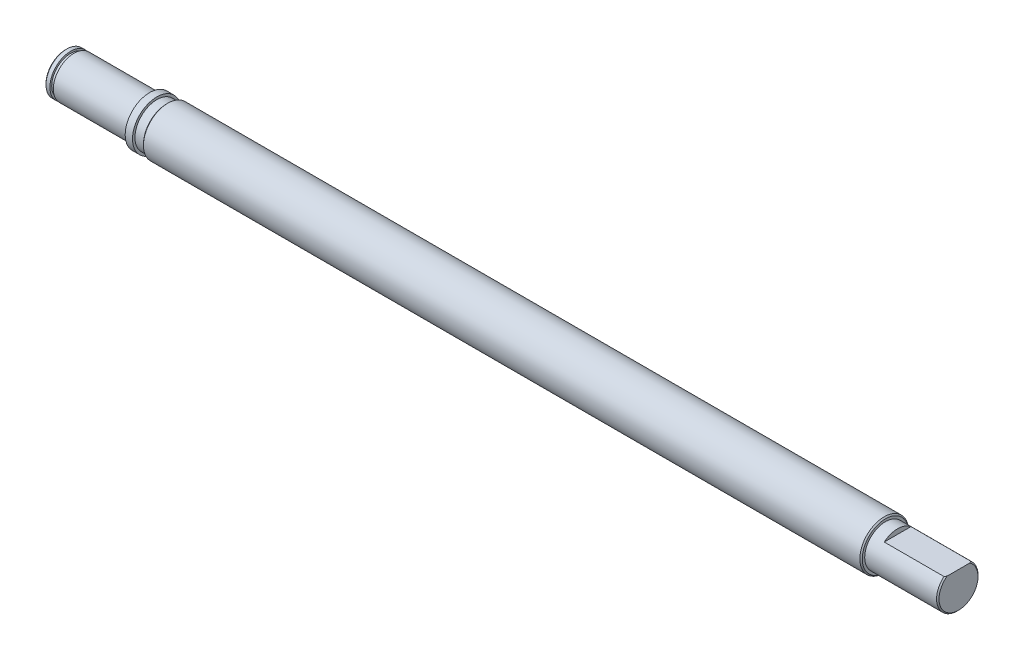
from build123d import *

# Parameters (mm, degrees)
CHAMFER_1_SIZE      = 0.5
CUT_EXTRUDE_START   = -25
CUT_EXTRUDE_1_DEPTH = 25


with BuildPart() as part:
    # Эскиз1 → Повернуть1 (revolve)
    with BuildSketch(Plane.XY):
        Polygon((0, 0), (0, 8.5), (-30, 8.5), (-30, 10), (-324.998327755, 10), (-324.998327755, 9), (-328.998327755, 9), (-328.998327755, 10), (-331.998327755, 10), (-331.998327755, 8.5), (-362.998327755, 8.5), (-362.998327755, 7.75), (-364.398327755, 7.75), (-364.398327755, 8.5), (-366.498327755, 8.5), (-366.498327755, 0), align=None)
    revolve(axis=Axis((-850.209513438, 0, 0), (1, 0, 0)))

    # Фаска1
    chamfer_1_edges = [part.edges().sort_by_distance(p)[0] for p in [
        (-30, -10, 0),
        (0, -8.5, 0),
        (-324.998327755, -10, 0),
        (-366.498327755, -8.5, 0),
    ]]
    chamfer(chamfer_1_edges, length=CHAMFER_1_SIZE)

    # Эскиз2 → Вырез-Вытянуть1 (cut)
    with BuildSketch(Plane(origin=(0, 0, 0), x_dir=(0, 0, -1), z_dir=(1, 0, 0)).offset(CUT_EXTRUDE_START)):
        with BuildLine():
            Line((-5.477225575, 6.5), (5.477225575, 6.5))
            ThreePointArc((5.477225575, 6.5), (0, 8.5), (-5.477225575, 6.5))
        make_face()
    extrude(amount=CUT_EXTRUDE_1_DEPTH, mode=Mode.SUBTRACT)


solid = part.part
